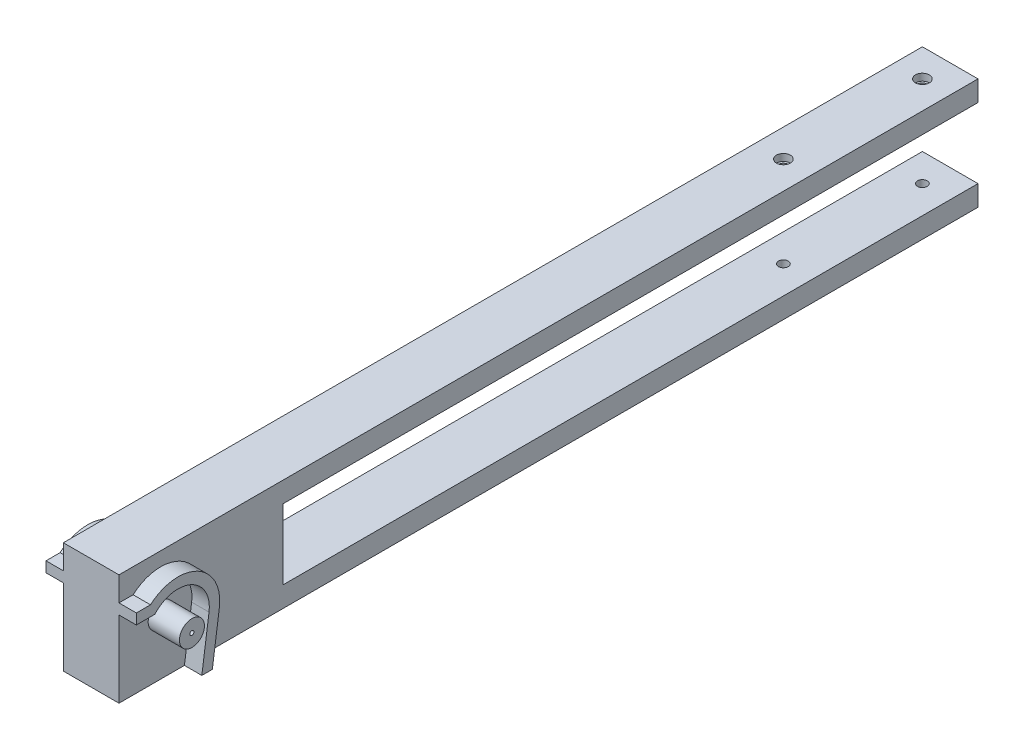
from build123d import *

# Parameters (mm, degrees)
SKETCH_2_W           = 23.6
SKETCH_2_H           = 16
EXTRUDE_1_DEPTH      = 4
EXTRUDE_START        = 4
EXTRUDE_3_DEPTH      = 4.5
SKETCH_5_R           = 0.3
CUT_EXTRUDE_10_DEPTH = 1
EXTRUDE_2_DEPTH      = 2.5
SKETCH_6_W           = 4
SKETCH_6_H           = 2.95
EXTRUDE_4_DEPTH      = 100
SKETCH_7_R           = 0.7
CUT_EXTRUDE_11_DEPTH = 119.987436312
SKETCH_7_3_R         = 1
SKETCH_7_3_R_2       = 0.7
CUT_EXTRUDE_12_DEPTH = 1
CUT_EXTRUDE_START    = -15
SKETCH_7_4_R         = 1
SKETCH_7_4_R_2       = 0.7
CUT_EXTRUDE_13_DEPTH = 1


with BuildPart() as part:
    # 草图2 → 凸台-拉伸1 (new body)
    with BuildSketch(Plane(origin=(0, 0, 0), x_dir=(0, 0, -1), z_dir=(1, 0, 0))):
        with Locations((5.8, 0)):
            Rectangle(SKETCH_2_W, SKETCH_2_H)
    extrude(amount=EXTRUDE_1_DEPTH)

    # 草图2<10> → 凸台-拉伸3 (add)
    with BuildSketch(Plane(origin=(0, 0, 0), x_dir=(0, 0, -1), z_dir=(1, 0, 0)).offset(EXTRUDE_START)):
        with BuildLine():
            ThreePointArc((0, -1.8), (1.272792206, -1.272792206), (1.8, 0))
            Line((1.8, 0), (0, 0))
            Line((0, 0), (0, -1.8))
        make_face()
        with BuildLine():
            Line((0, 0), (1.8, 0))
            ThreePointArc((1.8, 0), (1.272792206, 1.272792206), (0, 1.8))
            Line((0, 1.8), (0, 0))
        make_face()
        with BuildLine():
            Line((0, -1.8), (0, 0))
            Line((0, 0), (-1.8, 0))
            ThreePointArc((-1.8, 0), (-1.272792206, -1.272792206), (0, -1.8))
        make_face()
        with BuildLine():
            Line((-1.8, 0), (0, 0))
            Line((0, 0), (0, 1.8))
            ThreePointArc((0, 1.8), (-1.272792206, 1.272792206), (-1.8, 0))
        make_face()
    extrude(amount=EXTRUDE_3_DEPTH)

    # 草图5 → 切除-拉伸10 (cut)
    with BuildSketch(Plane(origin=(8.5, 0, 0), x_dir=(0, 0, -1), z_dir=(1, 0, 0))):
        Circle(SKETCH_5_R)
    extrude(amount=-CUT_EXTRUDE_10_DEPTH, mode=Mode.SUBTRACT)

    # 草图2<4> → 凸台-拉伸2 (add)
    with BuildSketch(Plane(origin=(0, 0, 0), x_dir=(0, 0, -1), z_dir=(1, 0, 0)).offset(EXTRUDE_START)):
        with BuildLine():
            ThreePointArc((-3.354101966, 3), (-1.837117307, 4.107919181), (0, 4.5))
            Line((0, 4.5), (-3.968626967, 4.5))
            ThreePointArc((-3.968626967, 4.5), (-4.643360347, 3.799895352), (-5.196152423, 3))
            Line((-5.196152423, 3), (-3.354101966, 3))
        make_face()
        with BuildLine():
            Line((0, 5), (1.8, 5))
            Line((1.8, 5), (1.8, 5.723635209))
            ThreePointArc((1.8, 5.723635209), (-1.245012655, 5.869407422), (-3.968626967, 4.5))
            Line((-3.968626967, 4.5), (0, 4.5))
            Line((0, 4.5), (0, 5))
        make_face()
        with BuildLine():
            ThreePointArc((0, 4.5), (0.919393397, 4.405078408), (1.8, 4.124318125))
            Line((1.8, 4.124318125), (1.8, 5))
            Line((1.8, 5), (0, 5))
            Line((0, 5), (0, 4.5))
        make_face()
        with BuildLine():
            ThreePointArc((1.8, 4.124318125), (3.764970119, 2.464751509), (4.5, 0))
            Line((4.5, 0), (6, 0))
            ThreePointArc((6, 0), (5.286764074, 2.837274331), (3.31662479, 5))
            Line((3.31662479, 5), (1.8, 5))
            Line((1.8, 5), (1.8, 4.124318125))
        make_face()
        with BuildLine():
            Line((1.8, 5.723635209), (1.8, 5))
            Line((1.8, 5), (3.31662479, 5))
            ThreePointArc((3.31662479, 5), (2.583771331, 5.415175501), (1.8, 5.723635209))
        make_face()
        with BuildLine():
            Line((6, 0), (4.5, 0))
            ThreePointArc((4.5, 0), (4.489038226, -0.313904132), (4.456206309, -0.626278954))
            Line((4.456206309, -0.626278954), (3.903880188, -4.556283516))
            ThreePointArc((3.903880188, -4.556283516), (5.262635021, -2.881782892), (5.941608412, -0.835038606))
            ThreePointArc((5.941608412, -0.835038606), (5.985384302, -0.418538842), (6, 0))
        make_face()
        with BuildLine():
            Line((5.356261262, -5), (5.941608412, -0.835038606))
            ThreePointArc((5.941608412, -0.835038606), (5.262635021, -2.881782892), (3.903880188, -4.556283516))
            Line((3.903880188, -4.556283516), (3.841519903, -5))
            Line((3.841519903, -5), (5.356261262, -5))
        make_face()
        Polygon((4.934638757, -8), (5.356261262, -5), (3.841519903, -5), (3.419897399, -8), align=None)
        with BuildLine():
            ThreePointArc((-5.196152423, 3), (-4.643360347, 3.799895352), (-3.968626967, 4.5))
            Line((-3.968626967, 4.5), (-6, 4.5))
            Line((-6, 4.5), (-6, 3))
            Line((-6, 3), (-5.196152423, 3))
        make_face()
    extrude(amount=EXTRUDE_2_DEPTH)

    # 草图6 → 凸台-拉伸4 (add)
    with BuildSketch(Plane(origin=(0, 0, -17.6), x_dir=(-1, 0, 0), z_dir=(0, 0, -1))):
        with Locations((-2, 6.525)):
            Rectangle(SKETCH_6_W, SKETCH_6_H)
        with Locations((-2, -6.525)):
            Rectangle(SKETCH_6_W, SKETCH_6_H)
    extrude(amount=EXTRUDE_4_DEPTH)

    # 镜向1: part across plane


with BuildPart() as part_1:
    add(part.part)
    add(part.part.mirror(Plane(origin=(0, 0, 0), x_dir=(0, 0, 1), z_dir=(1, 0, 0))))

    # 草图7 → 切除-拉伸11 (cut, through all)
    with BuildSketch(Plane(origin=(0, 8, 0), x_dir=(1, 0, 0), z_dir=(0, 1, 0))):
        with Locations(Location((0, 113.6, 0), (0, 0, 270))):
            Circle(SKETCH_7_R)
        with Locations(Location((0, 93.6, 0), (0, 0, 270))):
            Circle(SKETCH_7_R)
    extrude(amount=-CUT_EXTRUDE_11_DEPTH, mode=Mode.SUBTRACT)

    # 草图7<3> → 切除-拉伸12 (cut)
    # profile 1 of 2: a face of its own
    with BuildSketch(Plane(origin=(0, 8, 0), x_dir=(1, 0, 0), z_dir=(0, 1, 0))):
        with Locations(Location((0, 93.6, 0), (0, 0, 270))):
            Circle(SKETCH_7_3_R)
        with Locations(Location((0, 93.6, 0), (0, 0, 270))):
            Circle(SKETCH_7_3_R_2, mode=Mode.SUBTRACT)
    # profile 2 of 2: a face of its own
    with BuildSketch(Plane(origin=(0, 8, 0), x_dir=(1, 0, 0), z_dir=(0, 1, 0))):
        with Locations(Location((0, 113.6, 0), (0, 0, 270))):
            Circle(SKETCH_7_3_R)
        with Locations(Location((0, 113.6, 0), (0, 0, 270))):
            Circle(SKETCH_7_3_R_2, mode=Mode.SUBTRACT)
    extrude(amount=-CUT_EXTRUDE_12_DEPTH, mode=Mode.SUBTRACT)

    # 草图7<4> → 切除-拉伸13 (cut)
    # profile 1 of 2: a face of its own
    with BuildSketch(Plane(origin=(0, 8, 0), x_dir=(1, 0, 0), z_dir=(0, 1, 0)).offset(CUT_EXTRUDE_START)):
        with Locations(Location((0, 93.6, 0), (0, 0, 270))):
            Circle(SKETCH_7_4_R)
        with Locations(Location((0, 93.6, 0), (0, 0, 270))):
            Circle(SKETCH_7_4_R_2, mode=Mode.SUBTRACT)
    # profile 2 of 2: a face of its own
    with BuildSketch(Plane(origin=(0, 8, 0), x_dir=(1, 0, 0), z_dir=(0, 1, 0)).offset(CUT_EXTRUDE_START)):
        with Locations(Location((0, 113.6, 0), (0, 0, 270))):
            Circle(SKETCH_7_4_R)
        with Locations(Location((0, 113.6, 0), (0, 0, 270))):
            Circle(SKETCH_7_4_R_2, mode=Mode.SUBTRACT)
    extrude(amount=-CUT_EXTRUDE_13_DEPTH, mode=Mode.SUBTRACT)


solid = part_1.part
